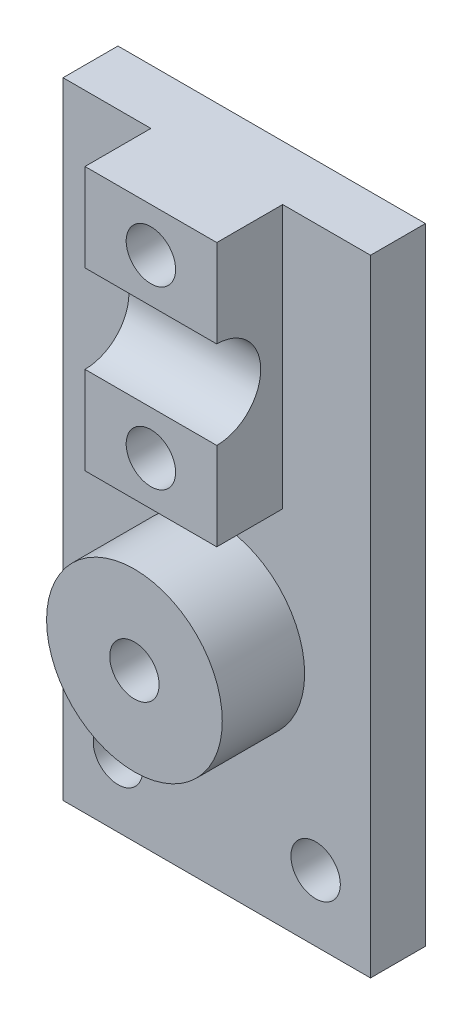
from build123d import *

# Parameters (mm, degrees)
SKETCH1_W           = 28
SKETCH1_H           = 57
BOSS_EXTRUDE1_DEPTH = 5
BOSS_EXTRUDE2_DEPTH = 6
SKETCH3_R           = 2.25
CUT_EXTRUDE1_DEPTH  = 60.715994507
SKETCH4_R           = 2.25
CUT_EXTRUDE2_DEPTH  = 60
SKETCH5_R           = 8
BOSS_EXTRUDE3_DEPTH = 7.5
SKETCH6_R           = 2.25
CUT_EXTRUDE3_DEPTH  = 61.010415763


with BuildPart() as part:
    # Sketch1 → Boss-Extrude1 (new body)
    with BuildSketch(Plane.XY):
        with Locations((0, -28.5)):
            Rectangle(SKETCH1_W, SKETCH1_H)
    extrude(amount=BOSS_EXTRUDE1_DEPTH)

    # Sketch2 → Boss-Extrude2 (add, symmetric)
    with BuildSketch(Plane(origin=(0, 0, 0), x_dir=(0, 0, -1), z_dir=(1, 0, 0))):
        with BuildLine():
            Line((-5, 0), (-5, -24))
            Line((-5, -24), (-11, -24))
            Line((-11, -24), (-11, -16))
            ThreePointArc((-11, -16), (-7, -12), (-11, -8))
            Line((-11, -8), (-11, 0))
            Line((-11, 0), (-5, 0))
        make_face()
    extrude(amount=BOSS_EXTRUDE2_DEPTH, both=True)

    # Sketch3 → Cut-Extrude1 (cut, through all)
    with BuildSketch(Plane.XY.offset(11)):
        with Locations((0, -4)):
            Circle(SKETCH3_R)
        with Locations((0, -20)):
            Circle(SKETCH3_R)
    extrude(amount=-CUT_EXTRUDE1_DEPTH, mode=Mode.SUBTRACT)

    # Sketch4 → Cut-Extrude2 (cut, through all)
    with BuildSketch(Plane.XY.offset(5)):
        with Locations((-9, -51)):
            Circle(SKETCH4_R)
        with Locations((9, -51)):
            Circle(SKETCH4_R)
    extrude(amount=-CUT_EXTRUDE2_DEPTH, mode=Mode.SUBTRACT)

    # Sketch5 → Boss-Extrude3 (add)
    with BuildSketch(Plane.XY.offset(5)):
        with Locations((0, -36)):
            Circle(SKETCH5_R)
    extrude(amount=BOSS_EXTRUDE3_DEPTH)

    # Sketch6 → Cut-Extrude3 (cut, through all)
    with BuildSketch(Plane.XY.offset(12.5)):
        with Locations((0, -36)):
            Circle(SKETCH6_R)
    extrude(amount=-CUT_EXTRUDE3_DEPTH, mode=Mode.SUBTRACT)


solid = part.part
